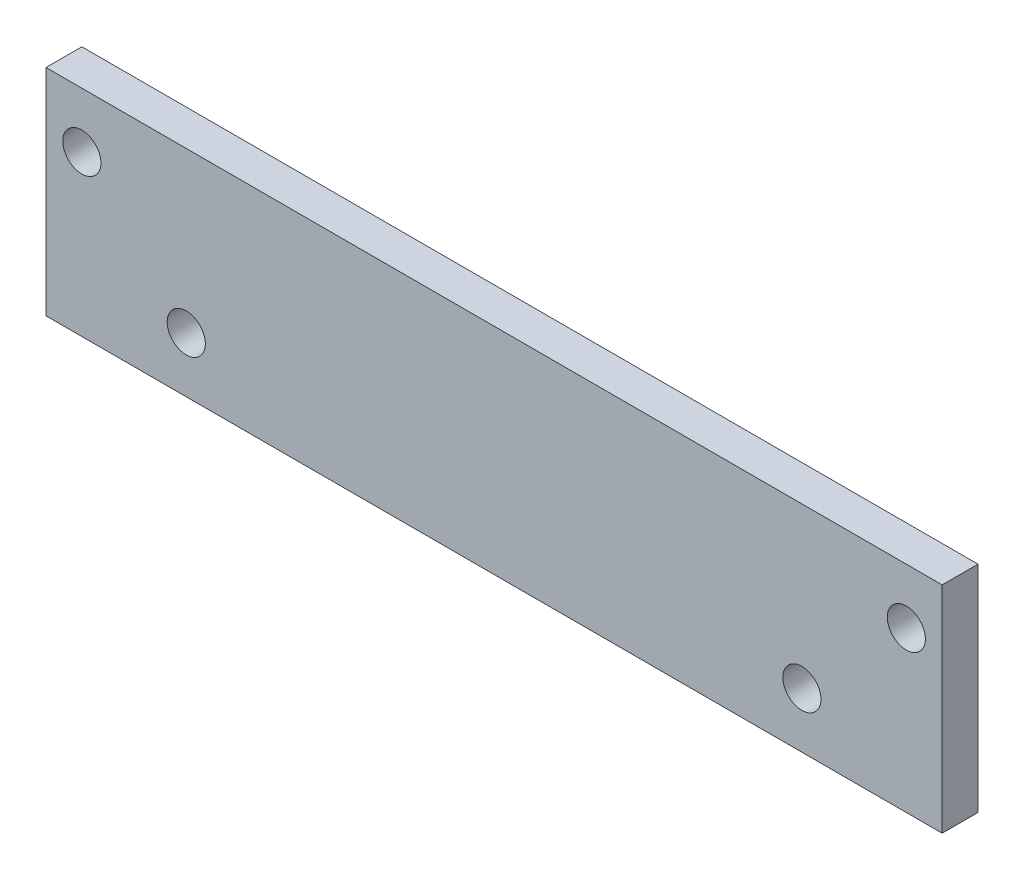
from build123d import *

# Parameters (mm, degrees)
SKETCH1_W               = 158.75
SKETCH1_H               = 38.1
BOSS_EXTRUDE1_DEPTH     = 6.35
F_1_4_CLEARANCE_HOLE1_D = 6.7564


with BuildPart() as part:
    # Sketch1 → Boss-Extrude1 (new body)
    with BuildSketch(Plane.XY):
        Rectangle(SKETCH1_W, SKETCH1_H)
    extrude(amount=BOSS_EXTRUDE1_DEPTH)

    # 1/4 Clearance Hole1 (through all)
    with Locations(Plane.XY.offset(6.35)):
        with Locations((-73.025, 9.249663805), (-54.525672391, -9.249663805)):
            f_1_4_clearance_hole1 = Hole(F_1_4_CLEARANCE_HOLE1_D / 2)

    # Mirror1: 1/4 Clearance Hole1 across plane
    add(f_1_4_clearance_hole1.mirror(Plane(origin=(0, 0, 0), x_dir=(0, 0, 1), z_dir=(1, 0, 0))), mode=Mode.SUBTRACT)


solid = part.part
